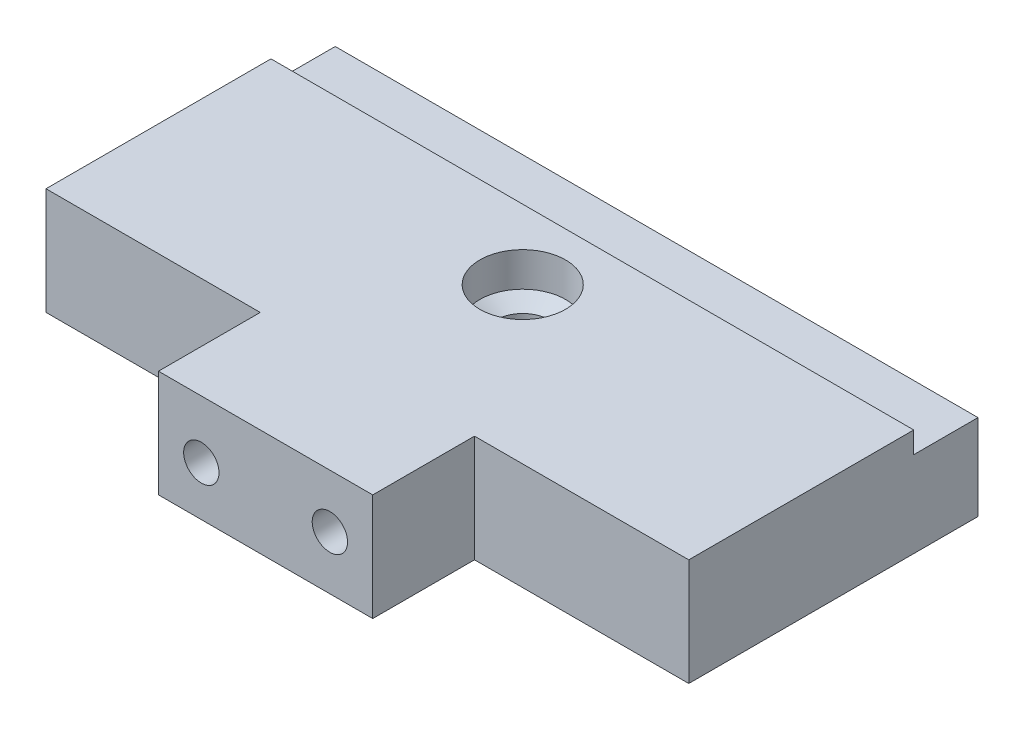
from build123d import *

# Parameters (mm, degrees)
BOSS_EXTRUDE5_DEPTH                 = 10
SKETCH2_8_W                         = 60
SKETCH2_8_H                         = 6
BOSS_EXTRUDE6_DEPTH                 = 8
F_8_0MM_CLEARANCE_DOWEL_HOLE1_D     = 8
F_8_0MM_CLEARANCE_DOWEL_HOLE1_DEPTH = 3.2
F_8_0MM_CLEARANCE_DOWEL_HOLE1_TIP   = 2.403442476
F_8_0MM_CLEARANCE_DOWEL_HOLE2_D     = 8
F_8_0MM_CLEARANCE_DOWEL_HOLE2_DEPTH = 3
F_8_0MM_CLEARANCE_DOWEL_HOLE2_TIP   = 2.403442476
F_5_0MM_CLEARANCE_DOWEL_HOLE5_D     = 5
M4_TAPPED_HOLE1_D                   = 3.3
M4_TAPPED_HOLE1_DEPTH               = 10.1
M4_TAPPED_HOLE1_TIP                 = 0.991420021
M4_TAPPED_HOLE2_D                   = 3.3
M4_TAPPED_HOLE2_DEPTH               = 10.1
M4_TAPPED_HOLE2_TIP                 = 0.991420021


with BuildPart() as part:
    # Sketch2 → Boss-Extrude5 (new body)
    with BuildSketch(Plane(origin=(0, 0, 0), x_dir=(1, 0, 0), z_dir=(0, 1, 0))):
        Polygon((40, 30.5), (-20, 30.5), (-20, 9.5), (0, 9.5), (0, 0), (20, 0), (20, 9.5), (40, 9.5), align=None)
    extrude(amount=BOSS_EXTRUDE5_DEPTH)

    # Sketch2<8> → Boss-Extrude6 (add)
    with BuildSketch(Plane(origin=(0, 0, 0), x_dir=(1, 0, 0), z_dir=(0, 1, 0))):
        with Locations((10, 33.5)):
            Rectangle(SKETCH2_8_W, SKETCH2_8_H)
    extrude(amount=BOSS_EXTRUDE6_DEPTH)

    # Ø8.0mm Clearance Dowel Hole1
    with Locations(Plane(origin=(0, 10, 0), x_dir=(1, 0, 0), z_dir=(0, 1, 0))):
        with Locations((10, 24)):
            Hole(F_8_0MM_CLEARANCE_DOWEL_HOLE1_D / 2, depth=F_8_0MM_CLEARANCE_DOWEL_HOLE1_DEPTH)
            with Locations((0, 0, -(F_8_0MM_CLEARANCE_DOWEL_HOLE1_DEPTH + F_8_0MM_CLEARANCE_DOWEL_HOLE1_TIP / 2))):  # 118° drill point
                Cone(0, F_8_0MM_CLEARANCE_DOWEL_HOLE1_D / 2, F_8_0MM_CLEARANCE_DOWEL_HOLE1_TIP, mode=Mode.SUBTRACT)

    # Ø8.0mm Clearance Dowel Hole2
    with Locations(Plane(origin=(0, 0, 0), x_dir=(-1, 0, 0), z_dir=(0, -1, 0))):
        with Locations((-10, 24)):
            Hole(F_8_0MM_CLEARANCE_DOWEL_HOLE2_D / 2, depth=F_8_0MM_CLEARANCE_DOWEL_HOLE2_DEPTH)
            with Locations((0, 0, -(F_8_0MM_CLEARANCE_DOWEL_HOLE2_DEPTH + F_8_0MM_CLEARANCE_DOWEL_HOLE2_TIP / 2))):  # 118° drill point
                Cone(0, F_8_0MM_CLEARANCE_DOWEL_HOLE2_D / 2, F_8_0MM_CLEARANCE_DOWEL_HOLE2_TIP, mode=Mode.SUBTRACT)

    # Ø5.0mm Clearance Dowel Hole5 (through all)
    with Locations(Plane(origin=(0, 0, 0), x_dir=(-1, 0, 0), z_dir=(0, -1, 0))):
        with Locations((-10, 24)):
            Hole(F_5_0MM_CLEARANCE_DOWEL_HOLE5_D / 2)

    # M4 Tapped Hole1
    with Locations(Plane.XY):
        with Locations((4, 4.604977991)):
            Hole(M4_TAPPED_HOLE1_D / 2, depth=M4_TAPPED_HOLE1_DEPTH)
            with Locations((0, 0, -(M4_TAPPED_HOLE1_DEPTH + M4_TAPPED_HOLE1_TIP / 2))):  # 118° drill point
                Cone(0, M4_TAPPED_HOLE1_D / 2, M4_TAPPED_HOLE1_TIP, mode=Mode.SUBTRACT)

    # M4 Tapped Hole2
    with Locations(Plane.XY):
        with Locations((16, 5.006947279)):
            Hole(M4_TAPPED_HOLE2_D / 2, depth=M4_TAPPED_HOLE2_DEPTH)
            with Locations((0, 0, -(M4_TAPPED_HOLE2_DEPTH + M4_TAPPED_HOLE2_TIP / 2))):  # 118° drill point
                Cone(0, M4_TAPPED_HOLE2_D / 2, M4_TAPPED_HOLE2_TIP, mode=Mode.SUBTRACT)


solid = part.part
